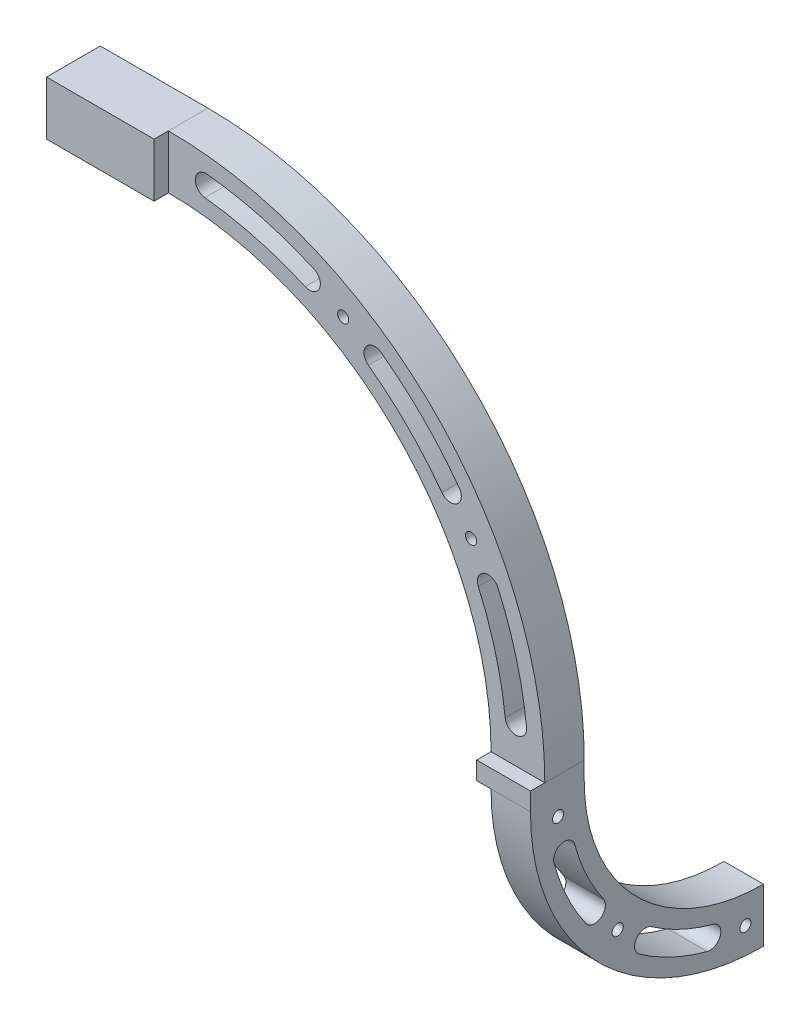
from build123d import *

# Parameters (mm, degrees)
EXTRUDE_1_DEPTH     = 15
SKETCH_2_W          = 15
SKETCH_2_H          = 15
EXTRUDE_2_DEPTH     = 5
EXTRUDE_3_DEPTH     = 15
SKETCH_4_R          = 1.55
CUT_EXTRUDE_1_DEPTH = 163.095650774
SKETCH_5_R          = 1.55
CUT_EXTRUDE_2_DEPTH = 157.68439616
CUT_EXTRUDE_START   = -4
CUT_EXTRUDE_4_DEPTH = 4
CUT_EXTRUDE_5_DEPTH = 4
SKETCH_9_W          = 15
SKETCH_9_H          = 15
EXTRUDE_4_DEPTH     = 30


with BuildPart() as part:
    # 草图1 → 凸台-拉伸1 (new body)
    with BuildSketch(Plane.XY):
        with BuildLine():
            Line((90, 0), (105, 0))
            ThreePointArc((105, 0), (74.246212025, 74.246212025), (0, 105))
            Line((0, 105), (0, 90))
            ThreePointArc((0, 90), (63.639610307, 63.639610307), (90, 0))
        make_face()
    extrude(amount=EXTRUDE_1_DEPTH)

    # 草图2 → 凸台-拉伸2 (add)
    with BuildSketch(Plane.XZ):
        with Locations((97.5, 7.5)):
            Rectangle(SKETCH_2_W, SKETCH_2_H)
    extrude(amount=EXTRUDE_2_DEPTH)

    # 草图3 → 凸台-拉伸3 (add)
    with BuildSketch(Plane(origin=(105, 0, 0), x_dir=(0, 0, -1), z_dir=(1, 0, 0))):
        with BuildLine():
            Line((50, -55), (50, -70))
            ThreePointArc((50, -70), (4.038059223, -50.961940777), (-15, -5))
            Line((-15, -5), (0, -5))
            ThreePointArc((0, -5), (14.644660941, -40.355339059), (50, -55))
        make_face()
    extrude(amount=-EXTRUDE_3_DEPTH)

    # 草图4 → 切除-拉伸1 (cut, through all)
    with BuildSketch(Plane.XY.offset(15)):
        with Locations((84.437476869, 48.75)):
            Circle(SKETCH_4_R)
        with Locations((48.75, 84.437476869)):
            Circle(SKETCH_4_R)
        with BuildLine():
            ThreePointArc((40.593936087, 91.936838933), (26.011314033, 97.075545542), (10.813039575, 99.916606103))
            ThreePointArc((10.813039575, 99.916606103), (7.507677018, 97.256798147), (10.167484974, 93.951435589))
            ThreePointArc((10.167484974, 93.951435589), (24.458399762, 91.279990584), (38.170417515, 86.448072429))
            ThreePointArc((38.170417515, 86.448072429), (42.126560053, 87.980696395), (40.593936087, 91.936838933))
        make_face()
        with BuildLine():
            ThreePointArc((81.123799357, 59.322670016), (71.064231509, 71.064231509), (59.322670016, 81.123799357))
            ThreePointArc((59.322670016, 81.123799357), (55.130238094, 80.473019377), (55.781018075, 76.280587456))
            ThreePointArc((55.781018075, 76.280587456), (66.821590822, 66.821590822), (76.280587456, 55.781018075))
            ThreePointArc((76.280587456, 55.781018075), (80.473019377, 55.130238094), (81.123799357, 59.322670016))
        make_face()
        with BuildLine():
            ThreePointArc((99.916606103, 10.813039575), (97.075545542, 26.011314033), (91.936838933, 40.593936087))
            ThreePointArc((91.936838933, 40.593936087), (87.980696395, 42.126560053), (86.448072429, 38.170417515))
            ThreePointArc((86.448072429, 38.170417515), (91.279990584, 24.458399762), (93.951435589, 10.167484974))
            ThreePointArc((93.951435589, 10.167484974), (97.256798147, 7.507677018), (99.916606103, 10.813039575))
        make_face()
    extrude(amount=-CUT_EXTRUDE_1_DEPTH, mode=Mode.SUBTRACT)

    # 草图5 → 切除-拉伸2 (cut, through all)
    with BuildSketch(Plane(origin=(105, 0, 0), x_dir=(0, 0, -1), z_dir=(1, 0, 0))):
        with Locations((44.969401847, -62.5)):
            Circle(SKETCH_5_R)
        with Locations((9.341360082, -45.658639918)):
            Circle(SKETCH_5_R)
        with Locations((-7.28119514, -10.011455208)):
            Circle(SKETCH_5_R)
        with BuildLine():
            ThreePointArc((-8.432245014, -20.681924073), (-4.831621116, -30.568404835), (0.427426106, -39.681550102))
            ThreePointArc((0.427426106, -39.681550102), (4.605316552, -40.419947976), (5.343714426, -36.24205753))
            ThreePointArc((5.343714426, -36.24205753), (0.606225607, -28.032695265), (-2.637311624, -19.126691933))
            ThreePointArc((-2.637311624, -19.126691933), (-6.312394389, -17.006841308), (-8.432245014, -20.681924073))
        make_face()
        with BuildLine():
            ThreePointArc((15.318449898, -54.572573894), (24.431595165, -59.831621116), (34.318075927, -63.432245014))
            ThreePointArc((34.318075927, -63.432245014), (37.993158692, -61.312394389), (35.873308067, -57.637311624))
            ThreePointArc((35.873308067, -57.637311624), (26.967304735, -54.393774393), (18.75794247, -49.656285574))
            ThreePointArc((18.75794247, -49.656285574), (14.580052024, -50.394683448), (15.318449898, -54.572573894))
        make_face()
    extrude(amount=-CUT_EXTRUDE_2_DEPTH, mode=Mode.SUBTRACT)

    # 草图7 → 切除-拉伸4 (cut)
    with BuildSketch(Plane.XY.offset(15).offset(CUT_EXTRUDE_START)):
        with BuildLine():
            Line((0, 105), (0, 90))
            ThreePointArc((0, 90), (63.639610307, 63.639610307), (90, 0))
            Line((90, 0), (105, 0))
            ThreePointArc((105, 0), (74.246212025, 74.246212025), (0, 105))
        make_face()
    extrude(amount=CUT_EXTRUDE_4_DEPTH, mode=Mode.SUBTRACT)

    # 草图8 → 切除-拉伸5 (cut)
    with BuildSketch(Plane.ZY.offset(-90).offset(CUT_EXTRUDE_START)):
        with BuildLine():
            Line((-50, -55), (-50, -70))
            ThreePointArc((-50, -70), (-4.038059223, -50.961940777), (15, -5))
            Line((15, -5), (0, -5))
            ThreePointArc((0, -5), (-14.644660941, -40.355339059), (-50, -55))
        make_face()
    extrude(amount=CUT_EXTRUDE_5_DEPTH, mode=Mode.SUBTRACT)

    # 草图9 → 凸台-拉伸4 (add)
    with BuildSketch(Plane.ZY):
        with Locations((7.5, 97.5)):
            Rectangle(SKETCH_9_W, SKETCH_9_H)
    extrude(amount=EXTRUDE_4_DEPTH)


solid = part.part
